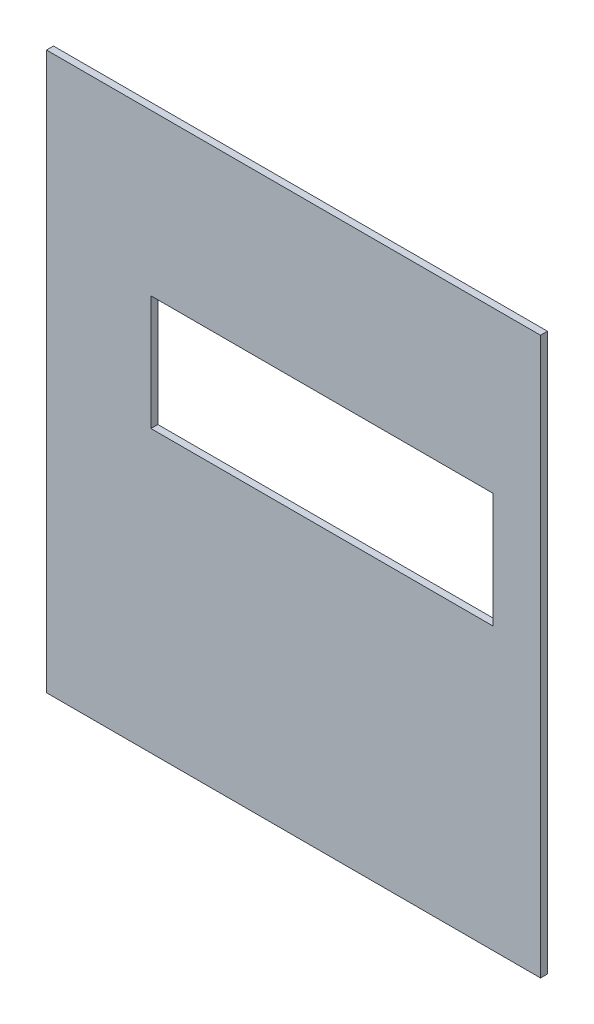
from build123d import *

# Parameters (mm, degrees)
ESQUISSE1_W             = 355
ESQUISSE1_H             = 400
BOSS_EXTRU_1_DEPTH      = 5
ESQUISSE6_W             = 246
ESQUISSE6_H             = 82.601797814
ENL_V_MAT_EXTRU_4_DEPTH = 268.453266946


with BuildPart() as part:
    # Esquisse1 → Boss.-Extru.1 (new body)
    with BuildSketch(Plane.XY):
        Rectangle(ESQUISSE1_W, ESQUISSE1_H)
    extrude(amount=BOSS_EXTRU_1_DEPTH)

    # Esquisse6 → Enlèv. mat.-Extru.4 (cut, through all)
    with BuildSketch(Plane.XY.offset(5)):
        with Locations((20.5, 43.262908986)):
            Rectangle(ESQUISSE6_W, ESQUISSE6_H)
    extrude(amount=-ENL_V_MAT_EXTRU_4_DEPTH, mode=Mode.SUBTRACT)


solid = part.part
